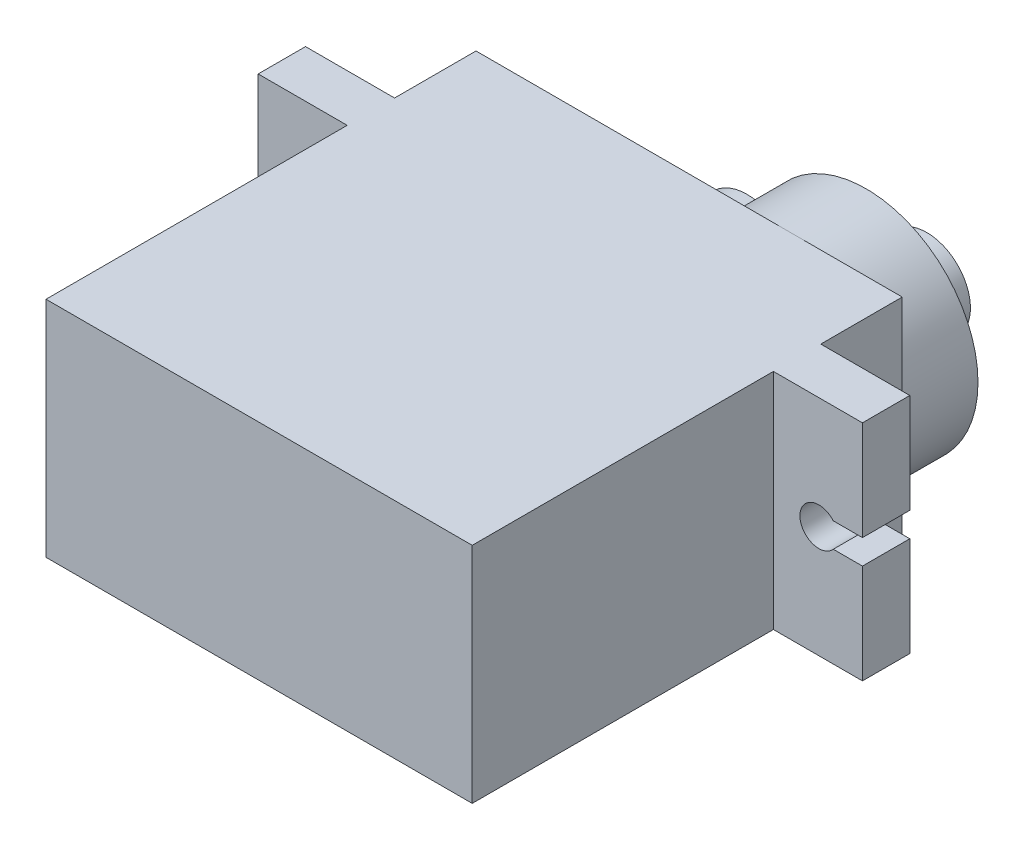
from build123d import *

# Parameters (mm, degrees)
SKETCH1_W           = 22.5
SKETCH1_H           = 22.7
BOSS_EXTRUDE1_DEPTH = 11.8
SKETCH2_W           = 31.9
SKETCH2_H           = 2.5
BOSS_EXTRUDE2_DEPTH = 11.8
BOSS_EXTRUDE3_DEPTH = 4
SKETCH4_R           = 2.3
BOSS_EXTRUDE4_DEPTH = 3.2
CUT_EXTRUDE1_DEPTH  = 3.2


with BuildPart() as part:
    # Sketch1 → Boss-Extrude1 (new body)
    with BuildSketch(Plane(origin=(0, 0, 0), x_dir=(1, 0, 0), z_dir=(0, 1, 0))):
        with Locations((11.25, 11.35)):
            Rectangle(SKETCH1_W, SKETCH1_H)
    extrude(amount=BOSS_EXTRUDE1_DEPTH)

    # Sketch2 → Boss-Extrude2 (add)
    with BuildSketch(Plane(origin=(0, 11.8, 0), x_dir=(1, 0, 0), z_dir=(0, 1, 0))):
        with Locations((11.25, 17.15)):
            Rectangle(SKETCH2_W, SKETCH2_H)
    extrude(amount=-BOSS_EXTRUDE2_DEPTH)

    # Sketch3 → Boss-Extrude3 (add)
    with BuildSketch(Plane(origin=(0, 0, -22.7), x_dir=(-1, 0, 0), z_dir=(0, 0, -1))):
        with BuildLine():
            ThreePointArc((-11.183333333, 8.238743727), (-22.5, 5.9), (-11.183333333, 3.561256273))
            ThreePointArc((-11.183333333, 3.561256273), (-7.8, 5.9), (-11.183333333, 8.238743727))
        make_face()
    extrude(amount=BOSS_EXTRUDE3_DEPTH)

    # Sketch4 → Boss-Extrude4 (add)
    with BuildSketch(Plane(origin=(0, 0, -26.7), x_dir=(-1, 0, 0), z_dir=(0, 0, -1))):
        with Locations((-16.6, 5.9)):
            Circle(SKETCH4_R)
    extrude(amount=BOSS_EXTRUDE4_DEPTH)

    # Sketch5 → Cut-Extrude1 (cut)
    with BuildSketch(Plane(origin=(0, 0, -18.4), x_dir=(-1, 0, 0), z_dir=(0, 0, -1))):
        with BuildLine():
            Line((-27.2, 5.25), (-27.2, 6.55))
            Line((-27.2, 6.55), (-25.659934208, 6.55))
            ThreePointArc((-25.659934208, 6.55), (-23.9, 5.9), (-25.659934208, 5.25))
            Line((-25.659934208, 5.25), (-27.2, 5.25))
        make_face()
        with BuildLine():
            Line((4.7, 5.25), (3.159934208, 5.25))
            ThreePointArc((3.159934208, 5.25), (1.4, 5.9), (3.159934208, 6.55))
            Line((3.159934208, 6.55), (4.7, 6.55))
            Line((4.7, 6.55), (4.7, 5.25))
        make_face()
    extrude(amount=-CUT_EXTRUDE1_DEPTH, mode=Mode.SUBTRACT)


solid = part.part
